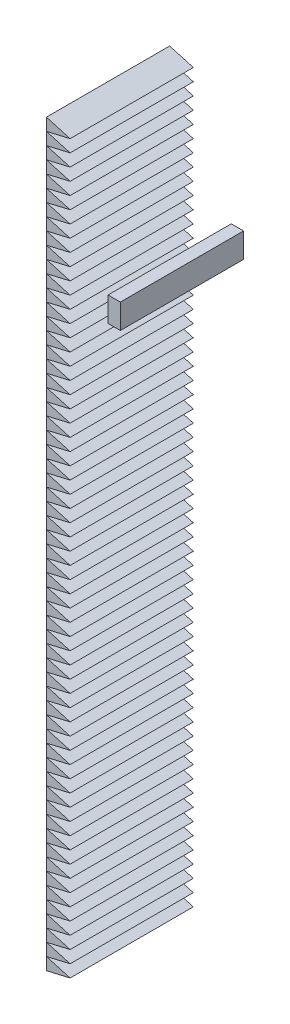
from build123d import *

# Parameters (mm, degrees)
SKETCH_2_W             = 10
SKETCH_2_H             = 20
EXTRUDE_2_DEPTH        = 100
EXTRUDE_1_DEPTH        = 100
PATTERN_LINEAR_1_COUNT = 60
PATTERN_LINEAR_1_PITCH = 10


with BuildPart() as part:
    # 草圖2 → 填料-伸長2 (new body)
    with BuildSketch(Plane.XY):
        with Locations((55, 490)):
            Rectangle(SKETCH_2_W, SKETCH_2_H)
    extrude(amount=EXTRUDE_2_DEPTH)


with BuildPart() as body_2:
    # 草圖1 → 填料-伸長1 (new body)
    with BuildSketch(Plane.XY):
        Polygon((0, 0), (0, 10), (19.225233919, 4.487252884), align=None)
    extrude(amount=EXTRUDE_1_DEPTH)


with BuildPart() as pattern_linear_1_1:
    # 直線複製排列1: pattern copy
    add(body_2.part.moved(Location(Vector(0, 1, 0) * (1 * PATTERN_LINEAR_1_PITCH))))


with BuildPart() as pattern_linear_1_2:
    # 直線複製排列1: pattern copy
    add(body_2.part.moved(Location(Vector(0, 1, 0) * (2 * PATTERN_LINEAR_1_PITCH))))


with BuildPart() as pattern_linear_1_3:
    # 直線複製排列1: pattern copy
    add(body_2.part.moved(Location(Vector(0, 1, 0) * (3 * PATTERN_LINEAR_1_PITCH))))


with BuildPart() as pattern_linear_1_4:
    # 直線複製排列1: pattern copy
    add(body_2.part.moved(Location(Vector(0, 1, 0) * (4 * PATTERN_LINEAR_1_PITCH))))


with BuildPart() as pattern_linear_1_5:
    # 直線複製排列1: pattern copy
    add(body_2.part.moved(Location(Vector(0, 1, 0) * (5 * PATTERN_LINEAR_1_PITCH))))


with BuildPart() as pattern_linear_1_6:
    # 直線複製排列1: pattern copy
    add(body_2.part.moved(Location(Vector(0, 1, 0) * (6 * PATTERN_LINEAR_1_PITCH))))


with BuildPart() as pattern_linear_1_7:
    # 直線複製排列1: pattern copy
    add(body_2.part.moved(Location(Vector(0, 1, 0) * (7 * PATTERN_LINEAR_1_PITCH))))


with BuildPart() as pattern_linear_1_8:
    # 直線複製排列1: pattern copy
    add(body_2.part.moved(Location(Vector(0, 1, 0) * (8 * PATTERN_LINEAR_1_PITCH))))


with BuildPart() as pattern_linear_1_9:
    # 直線複製排列1: pattern copy
    add(body_2.part.moved(Location(Vector(0, 1, 0) * (9 * PATTERN_LINEAR_1_PITCH))))


with BuildPart() as pattern_linear_1_10:
    # 直線複製排列1: pattern copy
    add(body_2.part.moved(Location(Vector(0, 1, 0) * (10 * PATTERN_LINEAR_1_PITCH))))


with BuildPart() as pattern_linear_1_11:
    # 直線複製排列1: pattern copy
    add(body_2.part.moved(Location(Vector(0, 1, 0) * (11 * PATTERN_LINEAR_1_PITCH))))


with BuildPart() as pattern_linear_1_12:
    # 直線複製排列1: pattern copy
    add(body_2.part.moved(Location(Vector(0, 1, 0) * (12 * PATTERN_LINEAR_1_PITCH))))


with BuildPart() as pattern_linear_1_13:
    # 直線複製排列1: pattern copy
    add(body_2.part.moved(Location(Vector(0, 1, 0) * (13 * PATTERN_LINEAR_1_PITCH))))


with BuildPart() as pattern_linear_1_14:
    # 直線複製排列1: pattern copy
    add(body_2.part.moved(Location(Vector(0, 1, 0) * (14 * PATTERN_LINEAR_1_PITCH))))


with BuildPart() as pattern_linear_1_15:
    # 直線複製排列1: pattern copy
    add(body_2.part.moved(Location(Vector(0, 1, 0) * (15 * PATTERN_LINEAR_1_PITCH))))


with BuildPart() as pattern_linear_1_16:
    # 直線複製排列1: pattern copy
    add(body_2.part.moved(Location(Vector(0, 1, 0) * (16 * PATTERN_LINEAR_1_PITCH))))


with BuildPart() as pattern_linear_1_17:
    # 直線複製排列1: pattern copy
    add(body_2.part.moved(Location(Vector(0, 1, 0) * (17 * PATTERN_LINEAR_1_PITCH))))


with BuildPart() as pattern_linear_1_18:
    # 直線複製排列1: pattern copy
    add(body_2.part.moved(Location(Vector(0, 1, 0) * (18 * PATTERN_LINEAR_1_PITCH))))


with BuildPart() as pattern_linear_1_19:
    # 直線複製排列1: pattern copy
    add(body_2.part.moved(Location(Vector(0, 1, 0) * (19 * PATTERN_LINEAR_1_PITCH))))


with BuildPart() as pattern_linear_1_20:
    # 直線複製排列1: pattern copy
    add(body_2.part.moved(Location(Vector(0, 1, 0) * (20 * PATTERN_LINEAR_1_PITCH))))


with BuildPart() as pattern_linear_1_21:
    # 直線複製排列1: pattern copy
    add(body_2.part.moved(Location(Vector(0, 1, 0) * (21 * PATTERN_LINEAR_1_PITCH))))


with BuildPart() as pattern_linear_1_22:
    # 直線複製排列1: pattern copy
    add(body_2.part.moved(Location(Vector(0, 1, 0) * (22 * PATTERN_LINEAR_1_PITCH))))


with BuildPart() as pattern_linear_1_23:
    # 直線複製排列1: pattern copy
    add(body_2.part.moved(Location(Vector(0, 1, 0) * (23 * PATTERN_LINEAR_1_PITCH))))


with BuildPart() as pattern_linear_1_24:
    # 直線複製排列1: pattern copy
    add(body_2.part.moved(Location(Vector(0, 1, 0) * (24 * PATTERN_LINEAR_1_PITCH))))


with BuildPart() as pattern_linear_1_25:
    # 直線複製排列1: pattern copy
    add(body_2.part.moved(Location(Vector(0, 1, 0) * (25 * PATTERN_LINEAR_1_PITCH))))


with BuildPart() as pattern_linear_1_26:
    # 直線複製排列1: pattern copy
    add(body_2.part.moved(Location(Vector(0, 1, 0) * (26 * PATTERN_LINEAR_1_PITCH))))


with BuildPart() as pattern_linear_1_27:
    # 直線複製排列1: pattern copy
    add(body_2.part.moved(Location(Vector(0, 1, 0) * (27 * PATTERN_LINEAR_1_PITCH))))


with BuildPart() as pattern_linear_1_28:
    # 直線複製排列1: pattern copy
    add(body_2.part.moved(Location(Vector(0, 1, 0) * (28 * PATTERN_LINEAR_1_PITCH))))


with BuildPart() as pattern_linear_1_29:
    # 直線複製排列1: pattern copy
    add(body_2.part.moved(Location(Vector(0, 1, 0) * (29 * PATTERN_LINEAR_1_PITCH))))


with BuildPart() as pattern_linear_1_30:
    # 直線複製排列1: pattern copy
    add(body_2.part.moved(Location(Vector(0, 1, 0) * (30 * PATTERN_LINEAR_1_PITCH))))


with BuildPart() as pattern_linear_1_31:
    # 直線複製排列1: pattern copy
    add(body_2.part.moved(Location(Vector(0, 1, 0) * (31 * PATTERN_LINEAR_1_PITCH))))


with BuildPart() as pattern_linear_1_32:
    # 直線複製排列1: pattern copy
    add(body_2.part.moved(Location(Vector(0, 1, 0) * (32 * PATTERN_LINEAR_1_PITCH))))


with BuildPart() as pattern_linear_1_33:
    # 直線複製排列1: pattern copy
    add(body_2.part.moved(Location(Vector(0, 1, 0) * (33 * PATTERN_LINEAR_1_PITCH))))


with BuildPart() as pattern_linear_1_34:
    # 直線複製排列1: pattern copy
    add(body_2.part.moved(Location(Vector(0, 1, 0) * (34 * PATTERN_LINEAR_1_PITCH))))


with BuildPart() as pattern_linear_1_35:
    # 直線複製排列1: pattern copy
    add(body_2.part.moved(Location(Vector(0, 1, 0) * (35 * PATTERN_LINEAR_1_PITCH))))


with BuildPart() as pattern_linear_1_36:
    # 直線複製排列1: pattern copy
    add(body_2.part.moved(Location(Vector(0, 1, 0) * (36 * PATTERN_LINEAR_1_PITCH))))


with BuildPart() as pattern_linear_1_37:
    # 直線複製排列1: pattern copy
    add(body_2.part.moved(Location(Vector(0, 1, 0) * (37 * PATTERN_LINEAR_1_PITCH))))


with BuildPart() as pattern_linear_1_38:
    # 直線複製排列1: pattern copy
    add(body_2.part.moved(Location(Vector(0, 1, 0) * (38 * PATTERN_LINEAR_1_PITCH))))


with BuildPart() as pattern_linear_1_39:
    # 直線複製排列1: pattern copy
    add(body_2.part.moved(Location(Vector(0, 1, 0) * (39 * PATTERN_LINEAR_1_PITCH))))


with BuildPart() as pattern_linear_1_40:
    # 直線複製排列1: pattern copy
    add(body_2.part.moved(Location(Vector(0, 1, 0) * (40 * PATTERN_LINEAR_1_PITCH))))


with BuildPart() as pattern_linear_1_41:
    # 直線複製排列1: pattern copy
    add(body_2.part.moved(Location(Vector(0, 1, 0) * (41 * PATTERN_LINEAR_1_PITCH))))


with BuildPart() as pattern_linear_1_42:
    # 直線複製排列1: pattern copy
    add(body_2.part.moved(Location(Vector(0, 1, 0) * (42 * PATTERN_LINEAR_1_PITCH))))


with BuildPart() as pattern_linear_1_43:
    # 直線複製排列1: pattern copy
    add(body_2.part.moved(Location(Vector(0, 1, 0) * (43 * PATTERN_LINEAR_1_PITCH))))


with BuildPart() as pattern_linear_1_44:
    # 直線複製排列1: pattern copy
    add(body_2.part.moved(Location(Vector(0, 1, 0) * (44 * PATTERN_LINEAR_1_PITCH))))


with BuildPart() as pattern_linear_1_45:
    # 直線複製排列1: pattern copy
    add(body_2.part.moved(Location(Vector(0, 1, 0) * (45 * PATTERN_LINEAR_1_PITCH))))


with BuildPart() as pattern_linear_1_46:
    # 直線複製排列1: pattern copy
    add(body_2.part.moved(Location(Vector(0, 1, 0) * (46 * PATTERN_LINEAR_1_PITCH))))


with BuildPart() as pattern_linear_1_47:
    # 直線複製排列1: pattern copy
    add(body_2.part.moved(Location(Vector(0, 1, 0) * (47 * PATTERN_LINEAR_1_PITCH))))


with BuildPart() as pattern_linear_1_48:
    # 直線複製排列1: pattern copy
    add(body_2.part.moved(Location(Vector(0, 1, 0) * (48 * PATTERN_LINEAR_1_PITCH))))


with BuildPart() as pattern_linear_1_49:
    # 直線複製排列1: pattern copy
    add(body_2.part.moved(Location(Vector(0, 1, 0) * (49 * PATTERN_LINEAR_1_PITCH))))


with BuildPart() as pattern_linear_1_50:
    # 直線複製排列1: pattern copy
    add(body_2.part.moved(Location(Vector(0, 1, 0) * (50 * PATTERN_LINEAR_1_PITCH))))


with BuildPart() as pattern_linear_1_51:
    # 直線複製排列1: pattern copy
    add(body_2.part.moved(Location(Vector(0, 1, 0) * (51 * PATTERN_LINEAR_1_PITCH))))


with BuildPart() as pattern_linear_1_52:
    # 直線複製排列1: pattern copy
    add(body_2.part.moved(Location(Vector(0, 1, 0) * (52 * PATTERN_LINEAR_1_PITCH))))


with BuildPart() as pattern_linear_1_53:
    # 直線複製排列1: pattern copy
    add(body_2.part.moved(Location(Vector(0, 1, 0) * (53 * PATTERN_LINEAR_1_PITCH))))


with BuildPart() as pattern_linear_1_54:
    # 直線複製排列1: pattern copy
    add(body_2.part.moved(Location(Vector(0, 1, 0) * (54 * PATTERN_LINEAR_1_PITCH))))


with BuildPart() as pattern_linear_1_55:
    # 直線複製排列1: pattern copy
    add(body_2.part.moved(Location(Vector(0, 1, 0) * (55 * PATTERN_LINEAR_1_PITCH))))


with BuildPart() as pattern_linear_1_56:
    # 直線複製排列1: pattern copy
    add(body_2.part.moved(Location(Vector(0, 1, 0) * (56 * PATTERN_LINEAR_1_PITCH))))


with BuildPart() as pattern_linear_1_57:
    # 直線複製排列1: pattern copy
    add(body_2.part.moved(Location(Vector(0, 1, 0) * (57 * PATTERN_LINEAR_1_PITCH))))


with BuildPart() as pattern_linear_1_58:
    # 直線複製排列1: pattern copy
    add(body_2.part.moved(Location(Vector(0, 1, 0) * (58 * PATTERN_LINEAR_1_PITCH))))


with BuildPart() as pattern_linear_1_59:
    # 直線複製排列1: pattern copy
    add(body_2.part.moved(Location(Vector(0, 1, 0) * (59 * PATTERN_LINEAR_1_PITCH))))


solid = Compound([part.part, body_2.part, pattern_linear_1_1.part, pattern_linear_1_2.part, pattern_linear_1_3.part, pattern_linear_1_4.part, pattern_linear_1_5.part, pattern_linear_1_6.part, pattern_linear_1_7.part, pattern_linear_1_8.part, pattern_linear_1_9.part, pattern_linear_1_10.part, pattern_linear_1_11.part, pattern_linear_1_12.part, pattern_linear_1_13.part, pattern_linear_1_14.part, pattern_linear_1_15.part, pattern_linear_1_16.part, pattern_linear_1_17.part, pattern_linear_1_18.part, pattern_linear_1_19.part, pattern_linear_1_20.part, pattern_linear_1_21.part, pattern_linear_1_22.part, pattern_linear_1_23.part, pattern_linear_1_24.part, pattern_linear_1_25.part, pattern_linear_1_26.part, pattern_linear_1_27.part, pattern_linear_1_28.part, pattern_linear_1_29.part, pattern_linear_1_30.part, pattern_linear_1_31.part, pattern_linear_1_32.part, pattern_linear_1_33.part, pattern_linear_1_34.part, pattern_linear_1_35.part, pattern_linear_1_36.part, pattern_linear_1_37.part, pattern_linear_1_38.part, pattern_linear_1_39.part, pattern_linear_1_40.part, pattern_linear_1_41.part, pattern_linear_1_42.part, pattern_linear_1_43.part, pattern_linear_1_44.part, pattern_linear_1_45.part, pattern_linear_1_46.part, pattern_linear_1_47.part, pattern_linear_1_48.part, pattern_linear_1_49.part, pattern_linear_1_50.part, pattern_linear_1_51.part, pattern_linear_1_52.part, pattern_linear_1_53.part, pattern_linear_1_54.part, pattern_linear_1_55.part, pattern_linear_1_56.part, pattern_linear_1_57.part, pattern_linear_1_58.part, pattern_linear_1_59.part])
